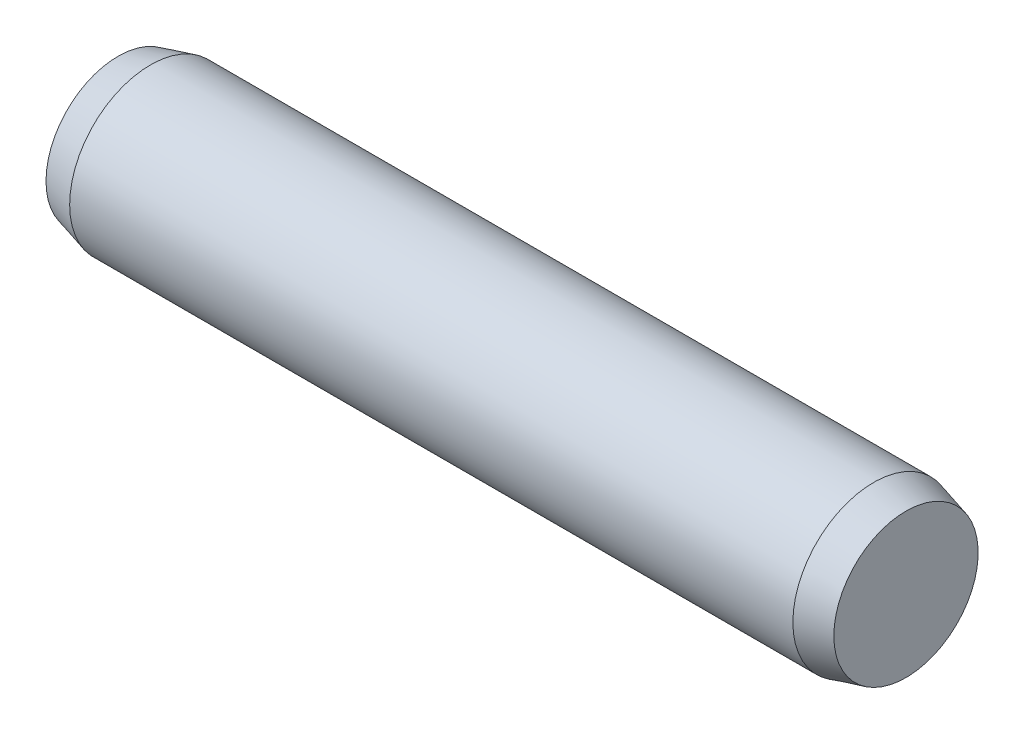
from build123d import *


with BuildPart() as part:
    # Sketch1 → Base-Revolve (revolve)
    with BuildSketch(Plane.XY, mode=Mode.PRIVATE) as base_revolve_sk:
        Polygon((0, 0), (39, 0), (39, 3.571281292), (37.4, 4), (1.6, 4), (0, 3.571281292), align=None)
    revolve(base_revolve_sk.sketch.rotate(Axis((-6.35, 0, 0), (1, 0, 0)), 90), axis=Axis((-6.35, 0, 0), (1, 0, 0)))


solid = part.part
